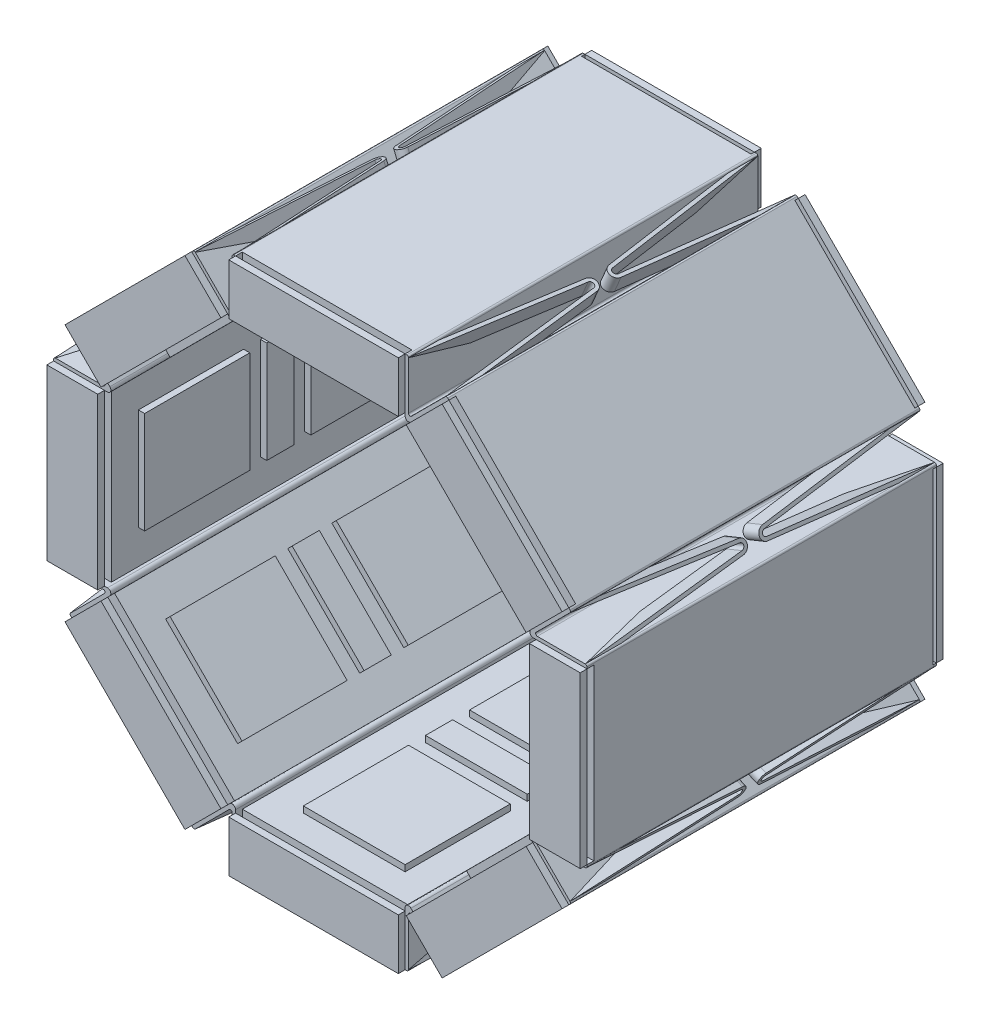
from build123d import *

# Parameters (mm, degrees)
SKETCH_1_W               = 12.7
SKETCH_1_H               = 3.81
EXTRUDE_1_DEPTH          = 24.892
EXTRUDE_1_2_DEPTH        = 24.892
SKETCH_1_W_2             = 3.81
SKETCH_1_H_2             = 12.7
EXTRUDE_1_3_DEPTH        = 24.892
EXTRUDE_1_4_DEPTH        = 24.892
EXTRUDE_1_5_DEPTH        = 24.892
EXTRUDE_1_6_DEPTH        = 24.892
EXTRUDE_1_7_DEPTH        = 24.892
EXTRUDE_1_8_DEPTH        = 24.892
SKETCH_5_W               = 7.62
SKETCH_5_H               = 0.518697006
SKETCH_5_W_2             = 0.518697006
SKETCH_5_H_2             = 7.62
EXTRUDE_4_DEPTH          = 7.874
SKETCH_7_W               = 7.62
SKETCH_7_H               = 0.465783619
SKETCH_7_W_2             = 0.465783619
SKETCH_7_H_2             = 7.62
EXTRUDE_6_DEPTH          = 1.016
EXTRUDE_7_DEPTH          = 26.162
SKETCH_9_W               = 12.7
SKETCH_9_H               = 3.81
EXTRUDE_8_DEPTH          = 0.508
EXTRUDE_8_2_DEPTH        = 0.508
SKETCH_9_W_2             = 3.81
SKETCH_9_H_2             = 12.7
EXTRUDE_8_3_DEPTH        = 0.508
EXTRUDE_8_4_DEPTH        = 0.508
EXTRUDE_8_5_DEPTH        = 0.508
EXTRUDE_8_6_DEPTH        = 0.508
EXTRUDE_8_7_DEPTH        = 0.508
EXTRUDE_8_8_DEPTH        = 0.508
SKETCH_10_W              = 12.7
SKETCH_10_H              = 3.81
EXTRUDE_9_DEPTH          = 0.508
EXTRUDE_9_2_DEPTH        = 0.508
SKETCH_10_W_2            = 3.81
SKETCH_10_H_2            = 12.7
EXTRUDE_9_3_DEPTH        = 0.508
EXTRUDE_9_4_DEPTH        = 0.508
EXTRUDE_9_5_DEPTH        = 0.508
EXTRUDE_9_6_DEPTH        = 0.508
EXTRUDE_9_7_DEPTH        = 0.508
EXTRUDE_9_8_DEPTH        = 0.508
EXTRUDE_11_DEPTH         = 1.27
PATTERN_CIRCULAR_1_COUNT = 8


with BuildPart() as part:
    # 草圖1 → 填料-伸長1 (new body)
    with BuildSketch(Plane.XY):
        with Locations((0, 18.066581106)):
            Rectangle(SKETCH_1_W, SKETCH_1_H)
    extrude(amount=EXTRUDE_1_DEPTH)



with BuildPart() as body_2:
    # 草圖1 → Extrude 1 2 (new body)
    with BuildSketch(Plane.XY):
        Polygon((9.631912371, 18.612168492), (18.612168492, 9.631912371), (15.918091656, 6.937835535), (6.937835535, 15.918091656), align=None)
    extrude(amount=EXTRUDE_1_2_DEPTH)


with BuildPart() as body_3:
    # 草圖1 → Extrude 1 3 (new body)
    with BuildSketch(Plane.XY):
        with Locations((18.066581106, 0)):
            Rectangle(SKETCH_1_W_2, SKETCH_1_H_2)
    extrude(amount=EXTRUDE_1_3_DEPTH)


with BuildPart() as body_4:
    # 草圖1 → Extrude 1 4 (new body)
    with BuildSketch(Plane.XY):
        Polygon((18.612168492, -9.631912371), (9.631912371, -18.612168492), (6.937835535, -15.918091656), (15.918091656, -6.937835535), align=None)
    extrude(amount=EXTRUDE_1_4_DEPTH)


with BuildPart() as body_5:
    # 草圖1 → Extrude 1 5 (new body)
    with BuildSketch(Plane.XY):
        with Locations((0, -18.066581106)):
            Rectangle(SKETCH_1_W, SKETCH_1_H)
    extrude(amount=EXTRUDE_1_5_DEPTH)


with BuildPart() as body_6:
    # 草圖1 → Extrude 1 6 (new body)
    with BuildSketch(Plane.XY):
        Polygon((-9.631912371, -18.612168492), (-18.612168492, -9.631912371), (-15.918091656, -6.937835535), (-6.937835535, -15.918091656), align=None)
    extrude(amount=EXTRUDE_1_6_DEPTH)


with BuildPart() as body_7:
    # 草圖1 → Extrude 1 7 (new body)
    with BuildSketch(Plane.XY):
        with Locations((-18.066581106, 0)):
            Rectangle(SKETCH_1_W_2, SKETCH_1_H_2)
    extrude(amount=EXTRUDE_1_7_DEPTH)


with BuildPart() as body_8:
    # 草圖1 → Extrude 1 8 (new body)
    with BuildSketch(Plane.XY):
        Polygon((-18.612168492, 9.631912371), (-9.631912371, 18.612168492), (-6.937835535, 15.918091656), (-15.918091656, 6.937835535), align=None)
    extrude(amount=EXTRUDE_1_8_DEPTH)


with BuildPart() as part_1:
    add(part.part)

    add(body_2.part)  # 填料-伸長4 merges body 2

    add(body_3.part)  # 填料-伸長4 merges body 3

    add(body_4.part)  # 填料-伸長4 merges body 4

    add(body_5.part)  # 填料-伸長4 merges body 5

    add(body_6.part)  # 填料-伸長4 merges body 6

    add(body_7.part)  # 填料-伸長4 merges body 7

    add(body_8.part)  # 填料-伸長4 merges body 8
    # 草圖5 → 填料-伸長4 (add)
    with BuildSketch(Plane.XY.offset(2.54)):
        with Locations((0, 15.95514599)):
            Rectangle(SKETCH_5_W, SKETCH_5_H)
        Polygon((8.771302173, 14.159455845), (14.159455845, 8.771302173), (13.792681676, 8.404528003), (8.404528003, 13.792681676), align=None)
        with Locations((15.95514599, 0)):
            Rectangle(SKETCH_5_W_2, SKETCH_5_H_2)
        Polygon((14.159455845, -8.771302173), (8.771302173, -14.159455845), (8.404528003, -13.792681676), (13.792681676, -8.404528003), align=None)
        with Locations((0, -15.95514599)):
            Rectangle(SKETCH_5_W, SKETCH_5_H)
        Polygon((-8.771302173, -14.159455845), (-14.159455845, -8.771302173), (-13.792681676, -8.404528003), (-8.404528003, -13.792681676), align=None)
        with Locations((-15.95514599, 0)):
            Rectangle(SKETCH_5_W_2, SKETCH_5_H_2)
        Polygon((-14.159455845, 8.771302173), (-8.771302173, 14.159455845), (-8.404528003, 13.792681676), (-13.792681676, 8.404528003), align=None)
    extrude_4 = extrude(amount=EXTRUDE_4_DEPTH)

    # 鏡射1: 填料-伸長4 across plane
    add(extrude_4.mirror(Plane.XY.offset(12.7)))

    # 草圖7 → 填料-伸長6 (add, symmetric)
    with BuildSketch(Plane.XY.offset(12.7)):
        Polygon((8.404528003, 13.792681676), (13.792681676, 8.404528003), (14.122040431, 8.733886759), (8.733886759, 14.122040431), align=None)
        with Locations((0, 15.928689296)):
            Rectangle(SKETCH_7_W, SKETCH_7_H)
        with Locations((15.928689296, 0)):
            Rectangle(SKETCH_7_W_2, SKETCH_7_H_2)
        Polygon((13.792681676, -8.404528003), (8.404528003, -13.792681676), (8.733886759, -14.122040431), (14.122040431, -8.733886759), align=None)
        with Locations((0, -15.928689296)):
            Rectangle(SKETCH_7_W, SKETCH_7_H)
        Polygon((-8.404528003, -13.792681676), (-13.792681676, -8.404528003), (-14.122040431, -8.733886759), (-8.733886759, -14.122040431), align=None)
        with Locations((-15.928689296, 0)):
            Rectangle(SKETCH_7_W_2, SKETCH_7_H_2)
        Polygon((-13.792681676, 8.404528003), (-8.404528003, 13.792681676), (-8.733886759, 14.122040431), (-14.122040431, 8.733886759), align=None)
    extrude(amount=EXTRUDE_6_DEPTH, both=True)

    # 草圖8 → 填料-伸長7 (add)
    with BuildSketch(Plane.XY.offset(25.4)):
        with BuildLine():
            Line((-6.604, 19.844581106), (-6.604, 16.250071488))
            ThreePointArc((-6.604, 16.250071488), (-6.682399204, 16.132738788), (-6.820802561, 16.160268927))
            Line((-6.820802561, 16.160268927), (-9.362504687, 18.701971053))
            ThreePointArc((-9.362504687, 18.701971053), (-9.452307248, 18.739168492), (-9.54210981, 18.701971053))
            Line((-9.54210981, 18.701971053), (-9.631912371, 18.612168492))
            Line((-9.631912371, 18.612168492), (-6.783605122, 15.763861243))
            ThreePointArc((-6.783605122, 15.763861243), (-6.506798408, 15.708800965), (-6.35, 15.943466366))
            Line((-6.35, 15.943466366), (-6.35, 19.971581106))
            Line((-6.35, 19.971581106), (-6.477, 19.971581106))
            ThreePointArc((-6.477, 19.971581106), (-6.566802561, 19.934383668), (-6.604, 19.844581106))
        make_face()
        with BuildLine():
            Line((9.362504687, 18.701971053), (6.820802561, 16.160268927))
            ThreePointArc((6.820802561, 16.160268927), (6.682399204, 16.132738788), (6.604, 16.250071488))
            Line((6.604, 16.250071488), (6.604, 19.844581106))
            ThreePointArc((6.604, 19.844581106), (6.566802561, 19.934383668), (6.477, 19.971581106))
            Line((6.477, 19.971581106), (6.35, 19.971581106))
            Line((6.35, 19.971581106), (6.35, 15.943466366))
            ThreePointArc((6.35, 15.943466366), (6.506798408, 15.708800965), (6.783605122, 15.763861243))
            Line((6.783605122, 15.763861243), (9.631912371, 18.612168492))
            Line((9.631912371, 18.612168492), (9.54210981, 18.701971053))
            ThreePointArc((9.54210981, 18.701971053), (9.452307248, 18.739168492), (9.362504687, 18.701971053))
        make_face()
        with BuildLine():
            Line((19.844581106, 6.604), (16.250071488, 6.604))
            ThreePointArc((16.250071488, 6.604), (16.132738788, 6.682399204), (16.160268927, 6.820802561))
            Line((16.160268927, 6.820802561), (18.701971053, 9.362504687))
            ThreePointArc((18.701971053, 9.362504687), (18.739168492, 9.452307248), (18.701971053, 9.54210981))
            Line((18.701971053, 9.54210981), (18.612168492, 9.631912371))
            Line((18.612168492, 9.631912371), (15.763861243, 6.783605122))
            ThreePointArc((15.763861243, 6.783605122), (15.708800965, 6.506798408), (15.943466366, 6.35))
            Line((15.943466366, 6.35), (19.971581106, 6.35))
            Line((19.971581106, 6.35), (19.971581106, 6.477))
            ThreePointArc((19.971581106, 6.477), (19.934383668, 6.566802561), (19.844581106, 6.604))
        make_face()
        with BuildLine():
            Line((18.701971053, -9.362504687), (16.160268927, -6.820802561))
            ThreePointArc((16.160268927, -6.820802561), (16.132738788, -6.682399204), (16.250071488, -6.604))
            Line((16.250071488, -6.604), (19.844581106, -6.604))
            ThreePointArc((19.844581106, -6.604), (19.934383668, -6.566802561), (19.971581106, -6.477))
            Line((19.971581106, -6.477), (19.971581106, -6.35))
            Line((19.971581106, -6.35), (15.943466366, -6.35))
            ThreePointArc((15.943466366, -6.35), (15.708800965, -6.506798408), (15.763861243, -6.783605122))
            Line((15.763861243, -6.783605122), (18.612168492, -9.631912371))
            Line((18.612168492, -9.631912371), (18.701971053, -9.54210981))
            ThreePointArc((18.701971053, -9.54210981), (18.739168492, -9.452307248), (18.701971053, -9.362504687))
        make_face()
        with BuildLine():
            Line((6.604, -19.844581106), (6.604, -16.250071488))
            ThreePointArc((6.604, -16.250071488), (6.682399204, -16.132738788), (6.820802561, -16.160268927))
            Line((6.820802561, -16.160268927), (9.362504687, -18.701971053))
            ThreePointArc((9.362504687, -18.701971053), (9.452307248, -18.739168492), (9.54210981, -18.701971053))
            Line((9.54210981, -18.701971053), (9.631912371, -18.612168492))
            Line((9.631912371, -18.612168492), (6.783605122, -15.763861243))
            ThreePointArc((6.783605122, -15.763861243), (6.506798408, -15.708800965), (6.35, -15.943466366))
            Line((6.35, -15.943466366), (6.35, -19.971581106))
            Line((6.35, -19.971581106), (6.477, -19.971581106))
            ThreePointArc((6.477, -19.971581106), (6.566802561, -19.934383668), (6.604, -19.844581106))
        make_face()
        with BuildLine():
            Line((-9.362504687, -18.701971053), (-6.820802561, -16.160268927))
            ThreePointArc((-6.820802561, -16.160268927), (-6.682399204, -16.132738788), (-6.604, -16.250071488))
            Line((-6.604, -16.250071488), (-6.604, -19.844581106))
            ThreePointArc((-6.604, -19.844581106), (-6.566802561, -19.934383668), (-6.477, -19.971581106))
            Line((-6.477, -19.971581106), (-6.35, -19.971581106))
            Line((-6.35, -19.971581106), (-6.35, -15.943466366))
            ThreePointArc((-6.35, -15.943466366), (-6.506798408, -15.708800965), (-6.783605122, -15.763861243))
            Line((-6.783605122, -15.763861243), (-9.631912371, -18.612168492))
            Line((-9.631912371, -18.612168492), (-9.54210981, -18.701971053))
            ThreePointArc((-9.54210981, -18.701971053), (-9.452307248, -18.739168492), (-9.362504687, -18.701971053))
        make_face()
        with BuildLine():
            Line((-19.844581106, -6.604), (-16.250071488, -6.604))
            ThreePointArc((-16.250071488, -6.604), (-16.132738788, -6.682399204), (-16.160268927, -6.820802561))
            Line((-16.160268927, -6.820802561), (-18.701971053, -9.362504687))
            ThreePointArc((-18.701971053, -9.362504687), (-18.739168492, -9.452307248), (-18.701971053, -9.54210981))
            Line((-18.701971053, -9.54210981), (-18.612168492, -9.631912371))
            Line((-18.612168492, -9.631912371), (-15.763861243, -6.783605122))
            ThreePointArc((-15.763861243, -6.783605122), (-15.708800965, -6.506798408), (-15.943466366, -6.35))
            Line((-15.943466366, -6.35), (-19.971581106, -6.35))
            Line((-19.971581106, -6.35), (-19.971581106, -6.477))
            ThreePointArc((-19.971581106, -6.477), (-19.934383668, -6.566802561), (-19.844581106, -6.604))
        make_face()
        with BuildLine():
            Line((-18.701971053, 9.362504687), (-16.160268927, 6.820802561))
            ThreePointArc((-16.160268927, 6.820802561), (-16.132738788, 6.682399204), (-16.250071488, 6.604))
            Line((-16.250071488, 6.604), (-19.844581106, 6.604))
            ThreePointArc((-19.844581106, 6.604), (-19.934383668, 6.566802561), (-19.971581106, 6.477))
            Line((-19.971581106, 6.477), (-19.971581106, 6.35))
            Line((-19.971581106, 6.35), (-15.943466366, 6.35))
            ThreePointArc((-15.943466366, 6.35), (-15.708800965, 6.506798408), (-15.763861243, 6.783605122))
            Line((-15.763861243, 6.783605122), (-18.612168492, 9.631912371))
            Line((-18.612168492, 9.631912371), (-18.701971053, 9.54210981))
            ThreePointArc((-18.701971053, 9.54210981), (-18.739168492, 9.452307248), (-18.701971053, 9.362504687))
        make_face()
    extrude(amount=-EXTRUDE_7_DEPTH)


with BuildPart() as body_2_2:
    # 草圖9 → 填料-伸長8 (new body)
    with BuildSketch(Plane.XY.offset(25.4)):
        with Locations((0, 18.066581106)):
            Rectangle(SKETCH_9_W, SKETCH_9_H)
    extrude_8 = extrude(amount=EXTRUDE_8_DEPTH)


with BuildPart() as body_3_2:
    # 草圖9 → Extrude 8 2 (new body)
    with BuildSketch(Plane.XY.offset(25.4)):
        Polygon((9.631912371, 18.612168492), (6.937835535, 15.918091656), (15.918091656, 6.937835535), (18.612168492, 9.631912371), align=None)
    extrude_8_2 = extrude(amount=EXTRUDE_8_2_DEPTH)


with BuildPart() as body_4_2:
    # 草圖9 → Extrude 8 3 (new body)
    with BuildSketch(Plane.XY.offset(25.4)):
        with Locations((18.066581106, 0)):
            Rectangle(SKETCH_9_W_2, SKETCH_9_H_2)
    extrude_8_3 = extrude(amount=EXTRUDE_8_3_DEPTH)


with BuildPart() as body_5_2:
    # 草圖9 → Extrude 8 4 (new body)
    with BuildSketch(Plane.XY.offset(25.4)):
        Polygon((18.612168492, -9.631912371), (15.918091656, -6.937835535), (6.937835535, -15.918091656), (9.631912371, -18.612168492), align=None)
    extrude_8_4 = extrude(amount=EXTRUDE_8_4_DEPTH)


with BuildPart() as body_6_2:
    # 草圖9 → Extrude 8 5 (new body)
    with BuildSketch(Plane.XY.offset(25.4)):
        with Locations((0, -18.066581106)):
            Rectangle(SKETCH_9_W, SKETCH_9_H)
    extrude_8_5 = extrude(amount=EXTRUDE_8_5_DEPTH)


with BuildPart() as body_7_2:
    # 草圖9 → Extrude 8 6 (new body)
    with BuildSketch(Plane.XY.offset(25.4)):
        Polygon((-9.631912371, -18.612168492), (-6.937835535, -15.918091656), (-15.918091656, -6.937835535), (-18.612168492, -9.631912371), align=None)
    extrude_8_6 = extrude(amount=EXTRUDE_8_6_DEPTH)


with BuildPart() as body_8_2:
    # 草圖9 → Extrude 8 7 (new body)
    with BuildSketch(Plane.XY.offset(25.4)):
        with Locations((-18.066581106, 0)):
            Rectangle(SKETCH_9_W_2, SKETCH_9_H_2)
    extrude_8_7 = extrude(amount=EXTRUDE_8_7_DEPTH)


with BuildPart() as body_9:
    # 草圖9 → Extrude 8 8 (new body)
    with BuildSketch(Plane.XY.offset(25.4)):
        Polygon((-18.612168492, 9.631912371), (-15.918091656, 6.937835535), (-6.937835535, 15.918091656), (-9.631912371, 18.612168492), align=None)
    extrude_8_8 = extrude(amount=EXTRUDE_8_8_DEPTH)


with BuildPart() as part_2:
    add(part_1.part)

    # 鏡射9: 填料-伸長8, Extrude 8 2, Extrude 8 3, Extrude 8 4, Extrude 8 5, Extrude 8 6, Extrude 8 7, Extrude 8 8 across plane
    add(extrude_8.mirror(Plane.XY.offset(12.7)))
    add(extrude_8_2.mirror(Plane.XY.offset(12.7)))
    add(extrude_8_3.mirror(Plane.XY.offset(12.7)))
    add(extrude_8_4.mirror(Plane.XY.offset(12.7)))
    add(extrude_8_5.mirror(Plane.XY.offset(12.7)))
    add(extrude_8_6.mirror(Plane.XY.offset(12.7)))
    add(extrude_8_7.mirror(Plane.XY.offset(12.7)))
    add(extrude_8_8.mirror(Plane.XY.offset(12.7)))

    # 草圖13 → 填料-伸長11 (add)
    with BuildSketch(Plane(origin=(19.214137021, -8.155917281, 0), x_dir=(0, 0, 1), z_dir=(0.9205048534524332, -0.3907311284892907, 0))):
        with BuildLine():
            Line((-0.762, 1.31078875), (11.40079573, 0.169576787))
            ThreePointArc((11.40079573, 0.169576787), (11.608028798, -0.055718036), (11.405382006, -0.285146846))
            Line((11.405382006, -0.285146846), (-0.762, -1.674881518))
            Line((-0.762, -1.674881518), (1.476275287, -1.674881518))
            Line((1.476275287, -1.674881518), (11.434205985, -0.537506071))
            ThreePointArc((11.434205985, -0.537506071), (11.86201588, -0.053156359), (11.424523848, 0.422466045))
            Line((11.424523848, 0.422466045), (1.956968334, 1.31078875))
            Line((1.956968334, 1.31078875), (-0.762, 1.31078875))
        make_face()
        with BuildLine():
            Line((25.4, 1.31078875), (22.681031666, 1.31078875))
            Line((22.681031666, 1.31078875), (13.213476152, 0.422466045))
            ThreePointArc((13.213476152, 0.422466045), (12.77598412, -0.053156359), (13.203794015, -0.537506071))
            Line((13.203794015, -0.537506071), (23.161724713, -1.674881518))
            Line((23.161724713, -1.674881518), (25.4, -1.674881518))
            Line((25.4, -1.674881518), (13.232617994, -0.285146846))
            ThreePointArc((13.232617994, -0.285146846), (13.029971202, -0.055718036), (13.23720427, 0.169576787))
            Line((13.23720427, 0.169576787), (25.4, 1.31078875))
        make_face()
    extrude_11 = extrude(amount=-EXTRUDE_11_DEPTH)

    # 環狀複製排列1: 填料-伸長11 ×8 about axis
    pattern_circular_1_axis = Axis((0, 0, 34.037167819), (0, 0, -1))
    for i in range(1, PATTERN_CIRCULAR_1_COUNT):
        add(extrude_11.rotate(pattern_circular_1_axis, i * 360 / PATTERN_CIRCULAR_1_COUNT))


with BuildPart() as body_10:
    # 草圖10 → 填料-伸長9 (new body)
    with BuildSketch(Plane.XY.offset(-0.762)):
        with Locations((0, 18.066581106)):
            Rectangle(SKETCH_10_W, SKETCH_10_H)
    extrude(amount=-EXTRUDE_9_DEPTH)


with BuildPart() as body_11:
    # 草圖10 → Extrude 9 2 (new body)
    with BuildSketch(Plane.XY.offset(-0.762)):
        Polygon((18.612168492, 9.631912371), (9.631912371, 18.612168492), (6.937835535, 15.918091656), (15.918091656, 6.937835535), align=None)
    extrude(amount=-EXTRUDE_9_2_DEPTH)


with BuildPart() as body_12:
    # 草圖10 → Extrude 9 3 (new body)
    with BuildSketch(Plane.XY.offset(-0.762)):
        with Locations((18.066581106, 0)):
            Rectangle(SKETCH_10_W_2, SKETCH_10_H_2)
    extrude(amount=-EXTRUDE_9_3_DEPTH)


with BuildPart() as body_13:
    # 草圖10 → Extrude 9 4 (new body)
    with BuildSketch(Plane.XY.offset(-0.762)):
        Polygon((9.631912371, -18.612168492), (18.612168492, -9.631912371), (15.918091656, -6.937835535), (6.937835535, -15.918091656), align=None)
    extrude(amount=-EXTRUDE_9_4_DEPTH)


with BuildPart() as body_14:
    # 草圖10 → Extrude 9 5 (new body)
    with BuildSketch(Plane.XY.offset(-0.762)):
        with Locations((0, -18.066581106)):
            Rectangle(SKETCH_10_W, SKETCH_10_H)
    extrude(amount=-EXTRUDE_9_5_DEPTH)


with BuildPart() as body_15:
    # 草圖10 → Extrude 9 6 (new body)
    with BuildSketch(Plane.XY.offset(-0.762)):
        Polygon((-18.612168492, -9.631912371), (-9.631912371, -18.612168492), (-6.937835535, -15.918091656), (-15.918091656, -6.937835535), align=None)
    extrude(amount=-EXTRUDE_9_6_DEPTH)


with BuildPart() as body_16:
    # 草圖10 → Extrude 9 7 (new body)
    with BuildSketch(Plane.XY.offset(-0.762)):
        with Locations((-18.066581106, 0)):
            Rectangle(SKETCH_10_W_2, SKETCH_10_H_2)
    extrude(amount=-EXTRUDE_9_7_DEPTH)


with BuildPart() as body_17:
    # 草圖10 → Extrude 9 8 (new body)
    with BuildSketch(Plane.XY.offset(-0.762)):
        Polygon((-9.631912371, 18.612168492), (-18.612168492, 9.631912371), (-15.918091656, 6.937835535), (-6.937835535, 15.918091656), align=None)
    extrude(amount=-EXTRUDE_9_8_DEPTH)


solid = Compound([body_2_2.part, body_3_2.part, body_4_2.part, body_5_2.part, body_6_2.part, body_7_2.part, body_8_2.part, body_9.part, part_2.part, body_10.part, body_11.part, body_12.part, body_13.part, body_14.part, body_15.part, body_16.part, body_17.part])
